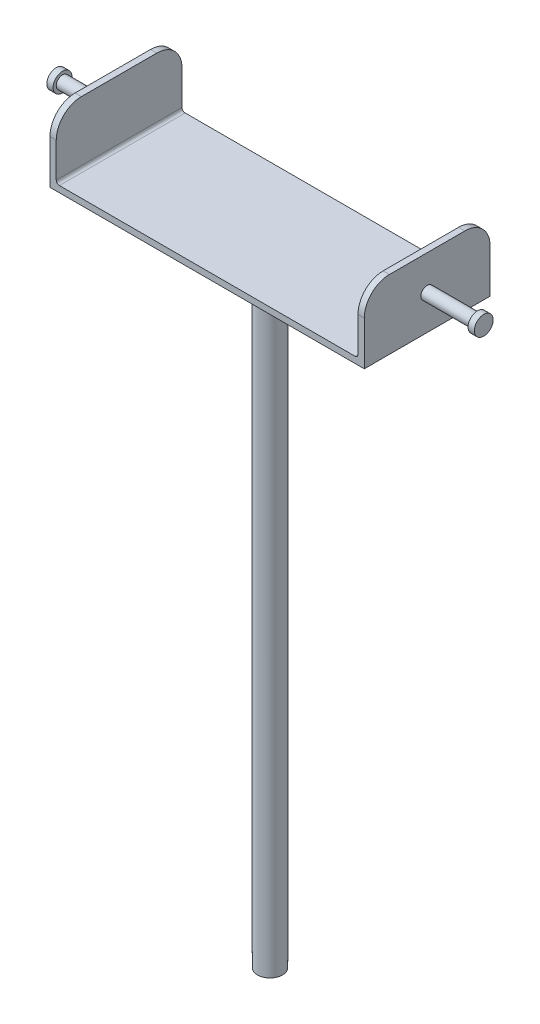
from build123d import *

# Parameters (mm, degrees)
SKETCH1_W            = 250
SKETCH1_H            = 100
BOSS_EXTRUDE1_DEPTH  = 5
SKETCH2_W            = 5
SKETCH2_H            = 100
BOSS_EXTRUDE2_DEPTH  = 50
FILLET1_R            = 20
BOSS_EXTRUDE3_START  = -250
SKETCH3_R            = 5
BOSS_EXTRUDE3_DEPTH  = 40
BOSS_EXTRUDE4_START  = 40
SKETCH3_2_R          = 5
BOSS_EXTRUDE4_DEPTH  = 40
SKETCH4_R            = 10
BOSS_EXTRUDE5_DEPTH  = 500
SKETCH6_R            = 7.5
BOSS_EXTRUDE9_DEPTH  = 5
BOSS_EXTRUDE11_START = 5
SKETCH7_R            = 7.5
BOSS_EXTRUDE11_DEPTH = 5
FILLET3_R            = 2.5


with BuildPart() as part:
    # Sketch1 → Boss-Extrude1 (new body)
    with BuildSketch(Plane(origin=(0, 0, 0), x_dir=(1, 0, 0), z_dir=(0, 1, 0))):
        Rectangle(SKETCH1_W, SKETCH1_H)
    extrude(amount=BOSS_EXTRUDE1_DEPTH)

    # Sketch2 → Boss-Extrude2 (add)
    with BuildSketch(Plane(origin=(0, 5, 0), x_dir=(1, 0, 0), z_dir=(0, 1, 0))):
        with Locations((-122.5, 0)):
            Rectangle(SKETCH2_W, SKETCH2_H)
        with Locations((122.5, 0)):
            Rectangle(SKETCH2_W, SKETCH2_H)
    extrude(amount=BOSS_EXTRUDE2_DEPTH)

    # Fillet1
    fillet1_edges = [part.edges().sort_by_distance(p)[0] for p in [
        (122.5, 55, -50),
        (122.5, 55, 50),
        (-122.5, 55, -50),
        (-122.5, 55, 50),
    ]]
    fillet(fillet1_edges, radius=FILLET1_R)

    # Sketch3 → Boss-Extrude3 (add)
    with BuildSketch(Plane.ZY.offset(125).offset(BOSS_EXTRUDE3_START)):
        with Locations((0, 27.5)):
            Circle(SKETCH3_R)
    extrude(amount=-BOSS_EXTRUDE3_DEPTH)

    # Sketch3<2> → Boss-Extrude4 (add)
    with BuildSketch(Plane.ZY.offset(125).offset(BOSS_EXTRUDE4_START)):
        with Locations((0, 27.5)):
            Circle(SKETCH3_2_R)
    extrude(amount=-BOSS_EXTRUDE4_DEPTH)

    # Sketch4 → Boss-Extrude5 (add)
    with BuildSketch(Plane(origin=(0, 0, 0), x_dir=(-1, 0, 0), z_dir=(0, -1, 0))):
        with Locations(Location((0, 0, 0), (0, 0, 270))):
            Circle(SKETCH4_R)
    extrude(amount=BOSS_EXTRUDE5_DEPTH)

    # Sketch6 → Boss-Extrude9 (add)
    with BuildSketch(Plane(origin=(165, 0, 0), x_dir=(0, 0, -1), z_dir=(1, 0, 0))):
        with Locations((0, 27.5)):
            Circle(SKETCH6_R)
    extrude(amount=BOSS_EXTRUDE9_DEPTH)

    # Sketch7 → Boss-Extrude11 (add)
    with BuildSketch(Plane.ZY.offset(165).offset(BOSS_EXTRUDE11_START)):
        with Locations(Location((0, 27.5, 0), (0, 0, 180))):
            Circle(SKETCH7_R)
    extrude(amount=-BOSS_EXTRUDE11_DEPTH)

    # Fillet3
    fillet3_edges = [part.edges().sort_by_distance(p)[0] for p in [
        (-120, 5, 0),
        (120, 5, 0),
    ]]
    fillet(fillet3_edges, radius=FILLET3_R)


solid = part.part
